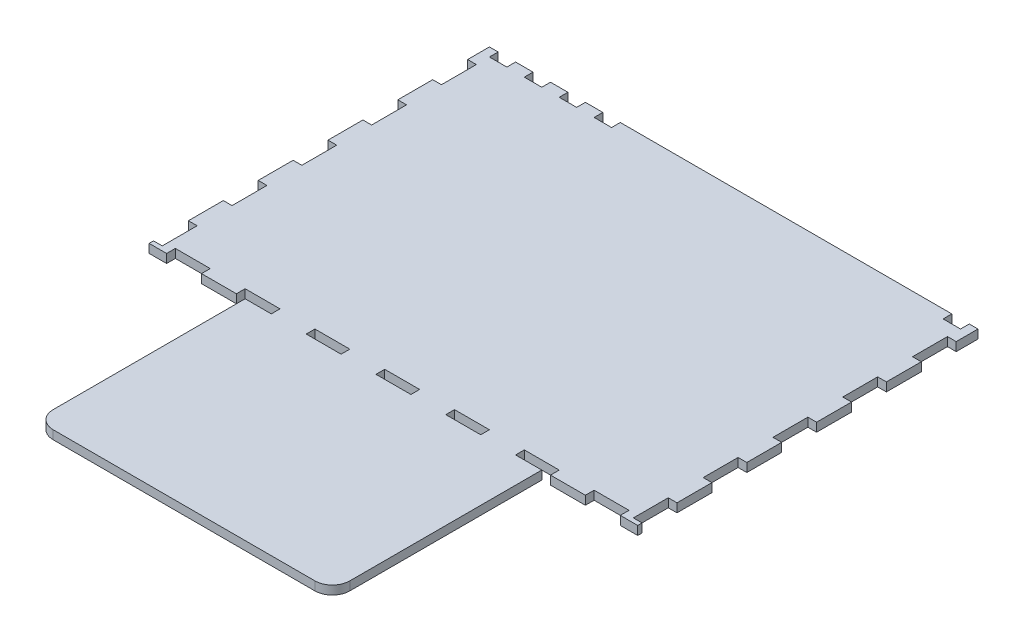
from build123d import *

# Parameters (mm, degrees)
ESQUISSE1_W                     = 355.6
ESQUISSE1_H                     = 368.3
BOSS_EXTRU_1_DEPTH              = 6.35
ESQUISSE2_W                     = 6.35
ESQUISSE2_H                     = 25.4
ENL_V_MAT_EXTRU_1_DEPTH         = 6.35
R_P_TITION_LIN_AIRE1_COUNT      = 7
R_P_TITION_LIN_AIRE1_PITCH      = 50.8
R_P_TITION_LIN_AIRE1_COUNT_DIR2 = 2
R_P_TITION_LIN_AIRE1_PITCH_DIR2 = 349.25
ESQUISSE3_W                     = 25.4
ESQUISSE3_H                     = 6.35
ENL_V_MAT_EXTRU_2_DEPTH         = 6.35
R_P_TITION_LIN_AIRE2_COUNT      = 7
R_P_TITION_LIN_AIRE2_PITCH      = 50.8
ESQUISSE4_W                     = 25.4
ESQUISSE4_H                     = 6.35
ENL_V_MAT_EXTRU_3_DEPTH         = 6.35
R_P_TITION_LIN_AIRE3_COUNT      = 7
R_P_TITION_LIN_AIRE3_PITCH      = 50.8
ESQUISSE5_W                     = 12.7
ESQUISSE5_H                     = 6.35
ENL_V_MAT_EXTRU_4_DEPTH         = 6.35
SKETCH3_W                       = 355.521495667
SKETCH3_H                       = 214.90407248
BOSS_EXTRUDE1_DEPTH             = 6.35
CUT_EXTRUDE2_DEPTH              = 331.396716197


with BuildPart() as part:
    # Esquisse1 → Boss.-Extru.1 (new body)
    with BuildSketch(Plane(origin=(0, 0, 0), x_dir=(1, 0, 0), z_dir=(0, 1, 0))):
        Rectangle(ESQUISSE1_W, ESQUISSE1_H)
    extrude(amount=BOSS_EXTRU_1_DEPTH)

    # Esquisse2 → Enlèv. mat.-Extru.1 (cut)
    with BuildSketch(Plane(origin=(0, 6.35, 0), x_dir=(1, 0, 0), z_dir=(0, 1, 0))):
        with Locations((174.625, -149.225)):
            Rectangle(ESQUISSE2_W, ESQUISSE2_H)
    enl_v_mat_extru_1 = extrude(amount=-ENL_V_MAT_EXTRU_1_DEPTH, mode=Mode.SUBTRACT)

    # Répétition linéaire1: Enl_v. mat.-Extru.1 7 × 2
    with Locations(*[(-j * R_P_TITION_LIN_AIRE1_PITCH_DIR2, 0, -i * R_P_TITION_LIN_AIRE1_PITCH) for i in range(R_P_TITION_LIN_AIRE1_COUNT) for j in range(R_P_TITION_LIN_AIRE1_COUNT_DIR2) if (i, j) != (0, 0)]):
        add(enl_v_mat_extru_1, mode=Mode.SUBTRACT)

    # Esquisse3 → Enlèv. mat.-Extru.2 (cut)
    with BuildSketch(Plane(origin=(0, 6.35, 0), x_dir=(1, 0, 0), z_dir=(0, 1, 0))):
        with Locations((-152.4, -180.975)):
            Rectangle(ESQUISSE3_W, ESQUISSE3_H)
    enl_v_mat_extru_2 = extrude(amount=-ENL_V_MAT_EXTRU_2_DEPTH, mode=Mode.SUBTRACT)

    # Répétition linéaire2: Enlèv. mat.-Extru.2 ×7
    with Locations(*[(i * R_P_TITION_LIN_AIRE2_PITCH, 0, 0) for i in range(1, R_P_TITION_LIN_AIRE2_COUNT)]):
        add(enl_v_mat_extru_2, mode=Mode.SUBTRACT)

    # Esquisse4 → Enlèv. mat.-Extru.3 (cut)
    with BuildSketch(Plane(origin=(0, 6.35, 0), x_dir=(1, 0, 0), z_dir=(0, 1, 0))):
        with Locations((-152.4, -60.325)):
            Rectangle(ESQUISSE4_W, ESQUISSE4_H)
    enl_v_mat_extru_3 = extrude(amount=-ENL_V_MAT_EXTRU_3_DEPTH, mode=Mode.SUBTRACT)

    # Répétition linéaire3: Enlèv. mat.-Extru.3 ×7
    with Locations(*[(i * R_P_TITION_LIN_AIRE3_PITCH, 0, 0) for i in range(1, R_P_TITION_LIN_AIRE3_COUNT)]):
        add(enl_v_mat_extru_3, mode=Mode.SUBTRACT)

    # Esquisse5 → Enlèv. mat.-Extru.4 (cut)
    with BuildSketch(Plane(origin=(0, 6.35, 0), x_dir=(1, 0, 0), z_dir=(0, 1, 0))):
        with Locations((-165.1, 180.975)):
            Rectangle(ESQUISSE5_W, ESQUISSE5_H)
        with Locations((165.1, 180.975)):
            Rectangle(ESQUISSE5_W, ESQUISSE5_H)
        with Locations((-139.7, 180.975)):
            Rectangle(ESQUISSE5_W, ESQUISSE5_H)
        with Locations((-114.3, 180.975)):
            Rectangle(ESQUISSE5_W, ESQUISSE5_H)
        with Locations((-88.9, 180.975)):
            Rectangle(ESQUISSE5_W, ESQUISSE5_H)
    extrude(amount=-ENL_V_MAT_EXTRU_4_DEPTH, mode=Mode.SUBTRACT)

    # Sketch3 → Boss-Extrude1 (add)
    with BuildSketch(Plane(origin=(0, 6.35, 0), x_dir=(1, 0, 0), z_dir=(0, 1, 0))):
        with Locations((-0.039252167, -170.95203624)):
            Rectangle(SKETCH3_W, SKETCH3_H)
    extrude(amount=-BOSS_EXTRUDE1_DEPTH)

    # Sketch1 → Cut-Extrude2 (cut, through all)
    with BuildSketch(Plane(origin=(0, 6.35, 0), x_dir=(1, 0, 0), z_dir=(0, 1, 0))):
        with BuildLine():
            Line((-95.25, -215.9), (95.25, -215.9))
            ThreePointArc((95.25, -215.9), (104.230256121, -212.180256121), (107.95, -203.2))
            Line((107.95, -203.2), (107.95, -63.5))
            Line((107.95, -63.5), (177.8, -63.5))
            Line((177.8, -63.5), (177.8, -278.40407248))
            Line((177.8, -278.40407248), (-177.8, -278.40407248))
            Line((-177.8, -278.40407248), (-177.8, -63.5))
            Line((-177.8, -63.5), (-107.95, -63.5))
            Line((-107.95, -63.5), (-107.95, -203.2))
            ThreePointArc((-107.95, -203.2), (-104.230256121, -212.180256121), (-95.25, -215.9))
        make_face()
    extrude(amount=-CUT_EXTRUDE2_DEPTH, mode=Mode.SUBTRACT)


solid = part.part
